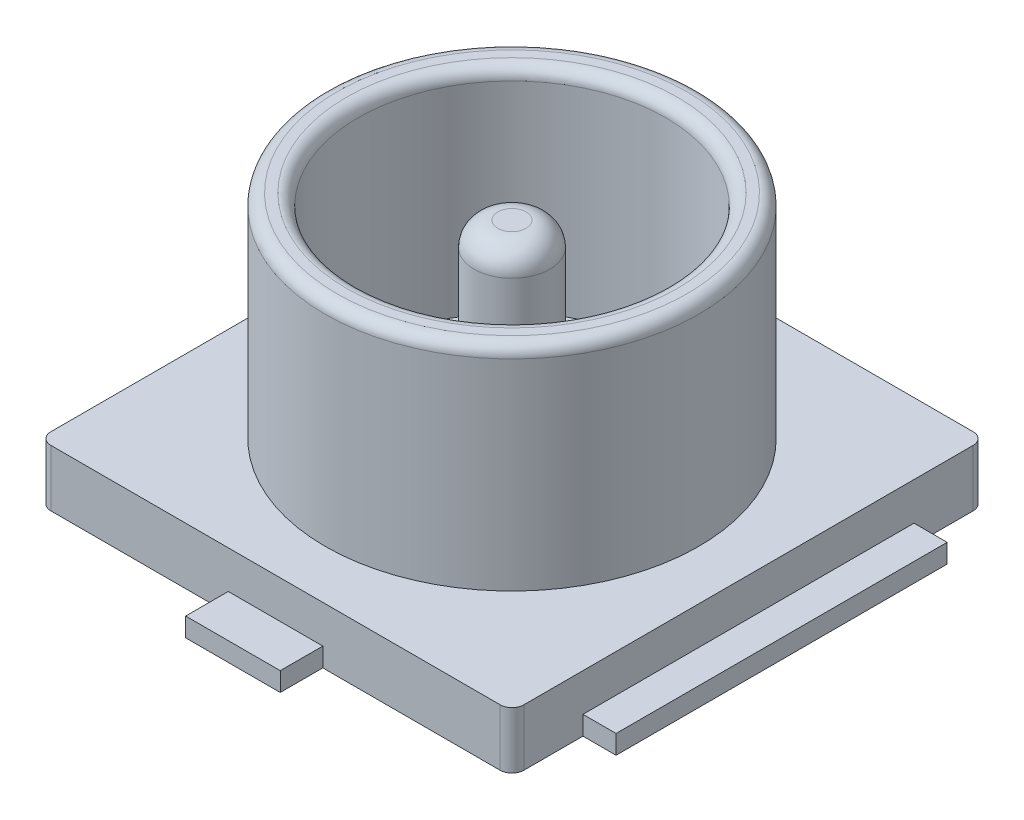
from build123d import *

# Parameters (mm, degrees)
SKETCH1_W           = 2.54
SKETCH1_H           = 2.54
BOSS_EXTRUDE1_DEPTH = 0.3048
FILLET2_R           = 0.0635
SKETCH2_R           = 1.0033
SKETCH2_R_2         = 0.8255
BOSS_EXTRUDE2_DEPTH = 1.143
FILLET3_R           = 0.0635
SKETCH3_R           = 0.2032
BOSS_EXTRUDE3_DEPTH = 1.016
FILLET1_R           = 0.127
SKETCH4_W           = 0.508
SKETCH4_H           = 0.2286
SKETCH4_W_2         = 0.1778
SKETCH4_H_2         = 1.778
BOSS_EXTRUDE4_DEPTH = 0.1016


with BuildPart() as part:
    # Sketch1 → Boss-Extrude1 (new body)
    with BuildSketch(Plane(origin=(0, 0, 0), x_dir=(1, 0, 0), z_dir=(0, 1, 0))):
        Rectangle(SKETCH1_W, SKETCH1_H)
    extrude(amount=BOSS_EXTRUDE1_DEPTH)

    # Fillet2
    fillet2_edges = [part.edges().sort_by_distance(p)[0] for p in [
        (1.27, 0.1524, 1.27),
        (-1.27, 0.1524, 1.27),
        (-1.27, 0.1524, -1.27),
        (1.27, 0.1524, -1.27),
    ]]
    fillet(fillet2_edges, radius=FILLET2_R)

    # Sketch2 → Boss-Extrude2 (add)
    with BuildSketch(Plane(origin=(0, 0.3048, 0), x_dir=(1, 0, 0), z_dir=(0, 1, 0))):
        with Locations(Location((0, 0, 0), (0, 0, 270))):
            Circle(SKETCH2_R)
        with Locations(Location((0, 0, 0), (0, 0, 270))):
            Circle(SKETCH2_R_2, mode=Mode.SUBTRACT)
    extrude(amount=BOSS_EXTRUDE2_DEPTH)

    # Fillet3
    fillet3_edges = [part.edges().sort_by_distance(p)[0] for p in [
        (0, 1.4478, -1.0033),
        (0, 1.4478, -0.8255),
    ]]
    fillet(fillet3_edges, radius=FILLET3_R)

    # Sketch3 → Boss-Extrude3 (add)
    with BuildSketch(Plane(origin=(0, 0.3048, 0), x_dir=(1, 0, 0), z_dir=(0, 1, 0))):
        with Locations(Location((0, 0, 0), (0, 0, 270))):
            Circle(SKETCH3_R)
    extrude(amount=BOSS_EXTRUDE3_DEPTH)

    # Fillet1
    fillet1_edges = [part.edges().sort_by_distance(p)[0] for p in [
        (0, 1.3208, -0.2032),
    ]]
    fillet(fillet1_edges, radius=FILLET1_R)

    # Sketch4 → Boss-Extrude4 (add)
    with BuildSketch(Plane(origin=(0, 0, 0), x_dir=(1, 0, 0), z_dir=(0, 1, 0))):
        with Locations((0, -1.3843)):
            Rectangle(SKETCH4_W, SKETCH4_H)
        with Locations((1.3589, 0)):
            Rectangle(SKETCH4_W_2, SKETCH4_H_2)
        with Locations((-1.3589, 0)):
            Rectangle(SKETCH4_W_2, SKETCH4_H_2)
    extrude(amount=BOSS_EXTRUDE4_DEPTH)


solid = part.part
